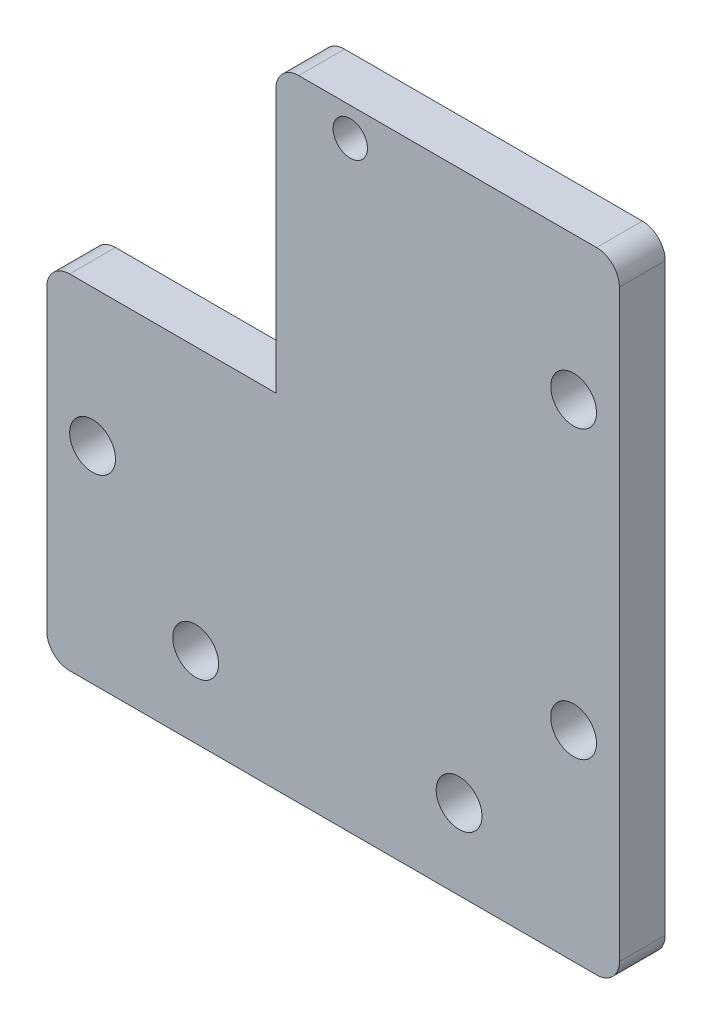
from build123d import *

# Parameters (mm, degrees)
BOSS_EXTRUDE1_DEPTH = 4
FILLET1_R           = 2
SKETCH3_R           = 1.5
SKETCH3_R_2         = 2
CUT_EXTRUDE1_DEPTH  = 10


with BuildPart() as part:
    # Sketch1 → Boss-Extrude1 (new body)
    with BuildSketch(Plane.XY):
        Polygon((-30, 55), (0, 55), (0, 0), (-50, 0), (-50, 30), (-30, 30), align=None)
    extrude(amount=BOSS_EXTRUDE1_DEPTH)

    # Fillet1
    fillet1_edges = [part.edges().sort_by_distance(p)[0] for p in [
        (0, 0, 2),
        (-50, 0, 2),
        (-50, 30, 2),
        (-30, 55, 2),
        (0, 55, 2),
    ]]
    fillet(fillet1_edges, radius=FILLET1_R)

    # Sketch3 → Cut-Extrude1 (cut)
    with BuildSketch(Plane.XY.offset(4)):
        with Locations((-23.5, 52.5)):
            Circle(SKETCH3_R)
        with Locations((-46, 18)):
            Circle(SKETCH3_R_2)
        with Locations((-37, 7)):
            Circle(SKETCH3_R_2)
        with Locations((-14, 7)):
            Circle(SKETCH3_R_2)
        with Locations((-4, 17.5)):
            Circle(SKETCH3_R_2)
        with Locations((-4, 42.5)):
            Circle(SKETCH3_R_2)
    extrude(amount=-CUT_EXTRUDE1_DEPTH, mode=Mode.SUBTRACT)


solid = part.part
